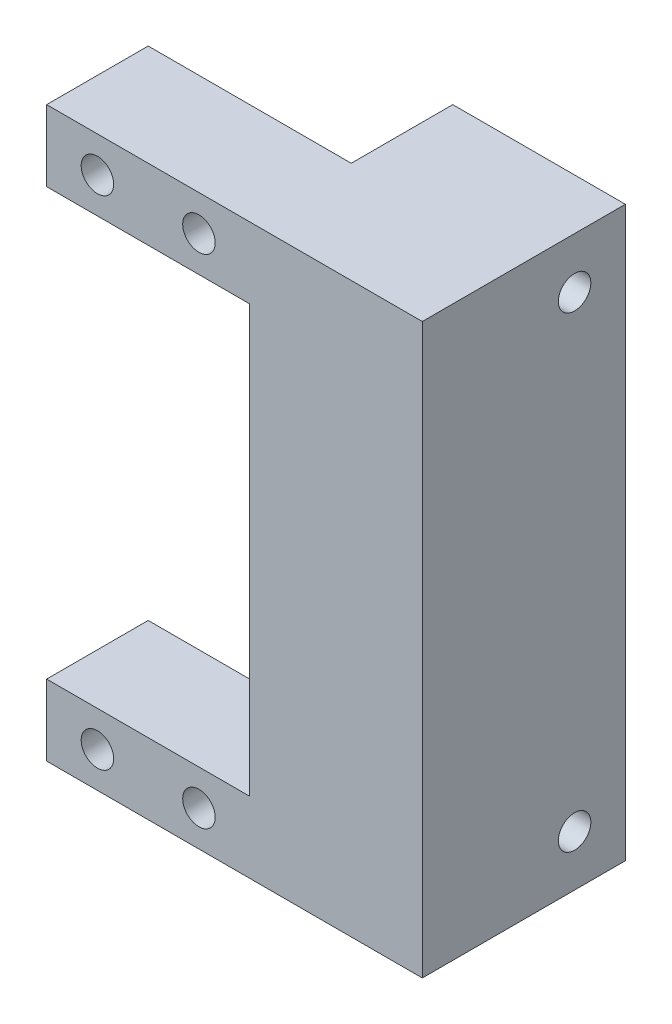
from build123d import *

# Parameters (mm, degrees)
EXTRUDE_1_DEPTH          = 10
SKETCH_2_R               = 1.6
CUT_EXTRUDE_1_DEPTH      = 10
SKETCH_3_W               = 7
SKETCH_3_H               = 56
EXTRUDE_2_DEPTH          = 10
CUT_EXTRUDE_2_DEPTH      = 40.155628782
CUT_EXTRUDE_2_DEPTH_BACK = 40.155628782
SKETCH_4_R               = 1.6
SKETCH_5_W               = 20
SKETCH_5_H               = 56
EXTRUDE_3_DEPTH          = 10
SKETCH_6_R               = 1.6
CUT_EXTRUDE_3_DEPTH      = 40.155628782


with BuildPart() as part:
    # ｽｹｯﾁ1 → ﾎﾞｽ - 押し出し1 (new body)
    with BuildSketch(Plane.XY):
        Polygon((-60.928571429, 23.857142857), (-60.928571429, 16.857142857), (-40.928571429, 16.857142857), (-40.928571429, -25.142857143), (-60.928571429, -25.142857143), (-60.928571429, -32.142857143), (-33.928571429, -32.142857143), (-33.928571429, 23.857142857), align=None)
    extrude(amount=EXTRUDE_1_DEPTH)

    # ｽｹｯﾁ2 → ｶｯﾄ - 押し出し1 (cut)
    with BuildSketch(Plane(origin=(0, 0, 0), x_dir=(-1, 0, 0), z_dir=(0, 0, -1))):
        with Locations((45.928571429, 20.357142857)):
            Circle(SKETCH_2_R)
        with Locations((55.928571429, 20.357142857)):
            Circle(SKETCH_2_R)
        with Locations((45.928571429, -28.642857143)):
            Circle(SKETCH_2_R)
        with Locations((55.928571429, -28.642857143)):
            Circle(SKETCH_2_R)
    extrude(amount=-CUT_EXTRUDE_1_DEPTH, mode=Mode.SUBTRACT)

    # ｽｹｯﾁ3 → ﾎﾞｽ - 押し出し2 (add)
    with BuildSketch(Plane(origin=(0, 0, 0), x_dir=(-1, 0, 0), z_dir=(0, 0, -1))):
        with Locations((37.428571429, -4.142857143)):
            Rectangle(SKETCH_3_W, SKETCH_3_H)
    extrude(amount=EXTRUDE_2_DEPTH)

    # ｽｹｯﾁ4 → ｶｯﾄ - 押し出し2 (cut, two sides: drawn at the far end of the back side and taken through both)
    with BuildSketch(Plane.ZY.offset(40.928571429).offset(-CUT_EXTRUDE_2_DEPTH_BACK)):
        with Locations(Location((-5, 18.857142857, 0), (0, 0, 270))):
            Circle(SKETCH_4_R)
        with Locations(Location((-5, -27.142857143, 0), (0, 0, 270))):
            Circle(SKETCH_4_R)
    extrude(amount=CUT_EXTRUDE_2_DEPTH + CUT_EXTRUDE_2_DEPTH_BACK, mode=Mode.SUBTRACT)

    # ｽｹｯﾁ5 → ﾎﾞｽ - 押し出し3 (add)
    with BuildSketch(Plane(origin=(-33.928571429, 0, 0), x_dir=(0, 0, -1), z_dir=(1, 0, 0))):
        with Locations((0, -4.142857143)):
            Rectangle(SKETCH_5_W, SKETCH_5_H)
    extrude(amount=EXTRUDE_3_DEPTH)

    # ｽｹｯﾁ6 → ｶｯﾄ - 押し出し3 (cut, through all)
    with BuildSketch(Plane.ZY.offset(40.928571429)):
        with Locations(Location((-5, 18.857142857, 0), (0, 0, 270))):
            Circle(SKETCH_6_R)
        with Locations(Location((-5, -27.142857143, 0), (0, 0, 270))):
            Circle(SKETCH_6_R)
    extrude(amount=-CUT_EXTRUDE_3_DEPTH, mode=Mode.SUBTRACT)


solid = part.part
